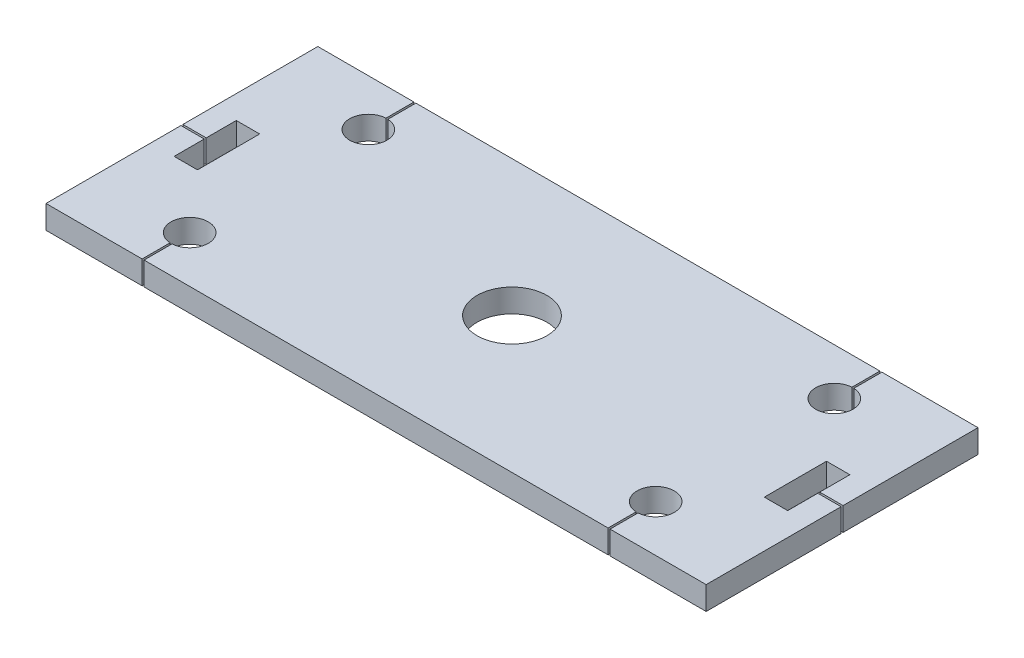
from build123d import *

# Parameters (mm, degrees)
ESBO_O2_W                = 85
ESBO_O2_H                = 35
RESSALTO_EXTRUS_O2_DEPTH = 3
ESBO_O3_W                = 3.01
ESBO_O3_H                = 8.005
CORTE_EXTRUS_O1_DEPTH    = 47.059743812
FURO_COM_FOLGA_DE_M41_D  = 4.8
FURO_COM_FOLGA_DE_M81_D  = 9
ESBO_O13_W               = 0.25
ESBO_O13_H               = 3.603257419
ESBO_O13_W_2             = 3
ESBO_O13_H_2             = 0.25
CORTE_EXTRUS_O2_DEPTH    = 47.059743812


with BuildPart() as part:
    # Esboço2 → Ressalto-extrusão2 (new body)
    with BuildSketch(Plane(origin=(0, 0, 0), x_dir=(1, 0, 0), z_dir=(0, 1, 0))):
        Rectangle(ESBO_O2_W, ESBO_O2_H)
    extrude(amount=RESSALTO_EXTRUS_O2_DEPTH)

    # Esboço3 → Corte-extrusão1 (cut, through all)
    with BuildSketch(Plane.XZ):
        with Locations((-37.995, 0)):
            Rectangle(ESBO_O3_W, ESBO_O3_H)
        with Locations((37.995, 0)):
            Rectangle(ESBO_O3_W, ESBO_O3_H)
    extrude(amount=-CORTE_EXTRUS_O1_DEPTH, mode=Mode.SUBTRACT)

    # Furo com folga de M41 (through all)
    with Locations(Plane(origin=(0, 0, 0), x_dir=(-1, 0, 0), z_dir=(0, -1, 0))):
        with Locations((30, -11.5), (30, 11.5), (-30, 11.5), (-30, -11.5)):
            Hole(FURO_COM_FOLGA_DE_M41_D / 2)

    # Furo com folga de M81 (through all)
    with Locations(Plane(origin=(0, 3, 0), x_dir=(1, 0, 0), z_dir=(0, 1, 0))):
        with Locations((0, 0)):
            Hole(FURO_COM_FOLGA_DE_M81_D / 2)

    # Esboço13 → Corte-extrusão2 (cut, through all)
    with BuildSketch(Plane(origin=(0, 3, 0), x_dir=(1, 0, 0), z_dir=(0, 1, 0))):
        with Locations((-30, 15.698371291)):
            Rectangle(ESBO_O13_W, ESBO_O13_H)
        with Locations((-41, 0)):
            Rectangle(ESBO_O13_W_2, ESBO_O13_H_2)
        with Locations((-30, -15.698371291)):
            Rectangle(ESBO_O13_W, ESBO_O13_H)
        with Locations((30, -15.698371291)):
            Rectangle(ESBO_O13_W, ESBO_O13_H)
        with Locations((41, 0)):
            Rectangle(ESBO_O13_W_2, ESBO_O13_H_2)
        with Locations((30, 15.698371291)):
            Rectangle(ESBO_O13_W, ESBO_O13_H)
    extrude(amount=-CORTE_EXTRUS_O2_DEPTH, mode=Mode.SUBTRACT)


solid = part.part
